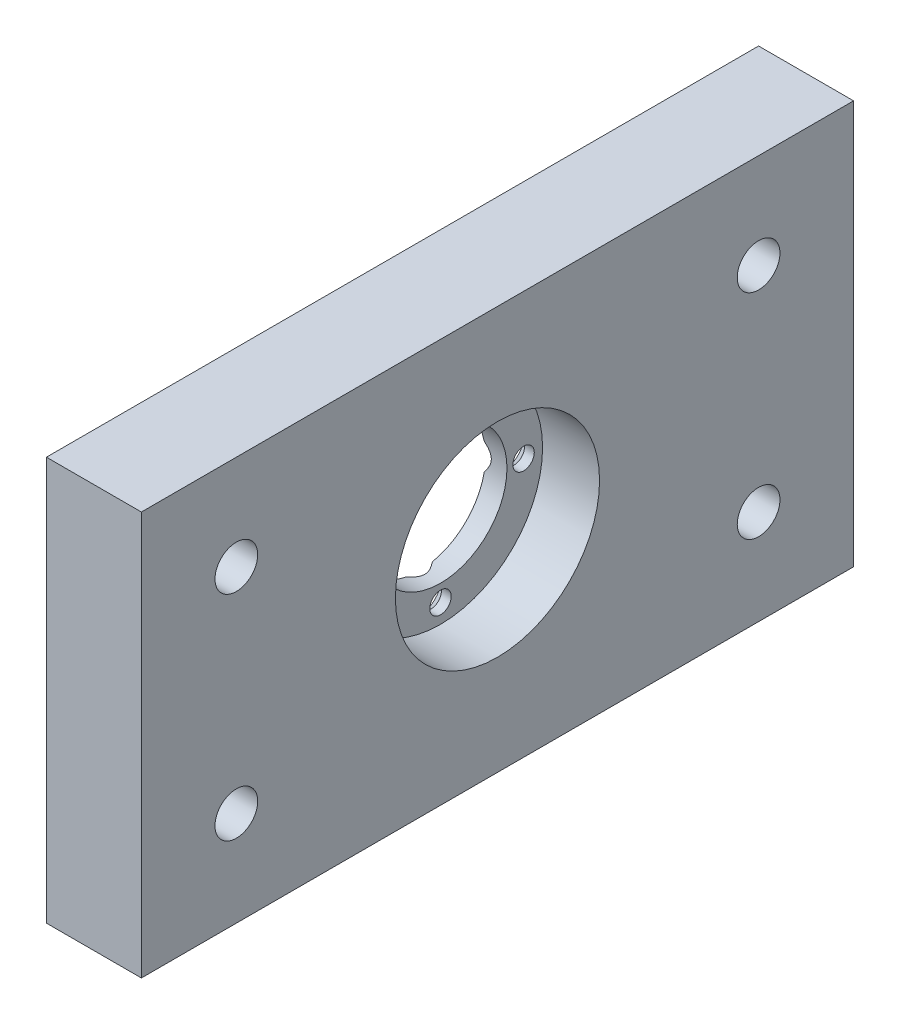
from build123d import *

# Parameters (mm, degrees)
BOSS_EXTRUDE1_DEPTH                             = 4.75
BOSS_EXTRUDE1_DEPTH_BACK                        = 15.25
SKETCH1_W                                       = 150
SKETCH1_H                                       = 85
SKETCH2_R                                       = 21.5
F_1MM_CLEARANCE_DEPTH                           = 12
SKETCH5_R                                       = 41
CUT_EXTRUDE2_DEPTH                              = 3.5
SKETCH6_R                                       = 14
CUT_EXTRUDE3_DEPTH                              = 11.5
CSK_FOR_M8_FLAT_HEAD_MACHINE_SCREW1_D           = 9
CSK_FOR_M8_FLAT_HEAD_MACHINE_SCREW1_CSINK_D     = 17.3
CSK_FOR_M8_FLAT_HEAD_MACHINE_SCREW1_CSINK_ANGLE = 90
CSK_FOR_M4_FLAT_HEAD_MACHINE_SCREW1_D           = 4.5
CSK_FOR_M4_FLAT_HEAD_MACHINE_SCREW1_CSINK_D     = 9.4
CSK_FOR_M4_FLAT_HEAD_MACHINE_SCREW1_CSINK_ANGLE = 90
M4X0_7_TAPPED_HOLE1_D                           = 3.3
M4X0_7_TAPPED_HOLE1_DEPTH                       = 10.1
M4X0_7_TAPPED_HOLE1_TIP                         = 0.991420021


with BuildPart() as part:
    # Sketch1 → Boss-Extrude1 (new, two sides: drawn at the far end of the back side and taken through both)
    with BuildSketch(Plane.ZY.offset(-152.244801117).offset(-BOSS_EXTRUDE1_DEPTH_BACK)):
        with Locations((-933.40139902, 151.879264394)):
            Rectangle(SKETCH1_W, SKETCH1_H)
    extrude(amount=BOSS_EXTRUDE1_DEPTH + BOSS_EXTRUDE1_DEPTH_BACK)

    # Sketch2 → 1mm clearance (cut)
    with BuildSketch(Plane(origin=(167.494801117, 0, 0), x_dir=(0, 0, -1), z_dir=(1, 0, 0))):
        with Locations((933.40139902, 151.879264394)):
            Circle(SKETCH2_R)
    extrude(amount=-F_1MM_CLEARANCE_DEPTH, mode=Mode.SUBTRACT)

    # Sketch5 → Cut-Extrude2 (cut)
    with BuildSketch(Plane.ZY.offset(-147.494801117)):
        with Locations((-933.40139902, 151.879264394)):
            Circle(SKETCH5_R)
    extrude(amount=-CUT_EXTRUDE2_DEPTH, mode=Mode.SUBTRACT)

    # Sketch6 → Cut-Extrude3 (cut)
    with BuildSketch(Plane.ZY.offset(-150.994801117)):
        with Locations((-933.40139902, 151.879264394)):
            Circle(SKETCH6_R)
    extrude(amount=-CUT_EXTRUDE3_DEPTH, mode=Mode.SUBTRACT)

    # CSK for M8 Flat Head Machine Screw1 (through all)
    with Locations(Plane.ZY.offset(-147.494801117)):
        with Locations((-878.40139902, 129.379264394), (-878.40139902, 174.379264394), (-988.40139902, 129.379264394), (-988.40139902, 174.379264394)):
            CounterSinkHole(CSK_FOR_M8_FLAT_HEAD_MACHINE_SCREW1_D / 2, CSK_FOR_M8_FLAT_HEAD_MACHINE_SCREW1_CSINK_D / 2, counter_sink_angle=CSK_FOR_M8_FLAT_HEAD_MACHINE_SCREW1_CSINK_ANGLE)

    # CSK for M4 Flat Head Machine Screw1 (through all)
    with Locations(Plane.ZY.offset(-150.994801117)):
        with Locations((-933.40139902, 134.379264394), (-950.90139902, 151.879264394), (-915.90139902, 151.879264394), (-933.40139902, 169.379264394)):
            CounterSinkHole(CSK_FOR_M4_FLAT_HEAD_MACHINE_SCREW1_D / 2, CSK_FOR_M4_FLAT_HEAD_MACHINE_SCREW1_CSINK_D / 2, counter_sink_angle=CSK_FOR_M4_FLAT_HEAD_MACHINE_SCREW1_CSINK_ANGLE)

    # M4x0.7 Tapped Hole1
    with Locations(Plane.ZY.offset(-147.494801117)):
        with Locations((-878.40139902, 151.879264394), (-973.40139902, 121.879264394), (-973.40139902, 181.879264394)):
            Hole(M4X0_7_TAPPED_HOLE1_D / 2, depth=M4X0_7_TAPPED_HOLE1_DEPTH)
            with Locations((0, 0, -(M4X0_7_TAPPED_HOLE1_DEPTH + M4X0_7_TAPPED_HOLE1_TIP / 2))):  # 118° drill point
                Cone(0, M4X0_7_TAPPED_HOLE1_D / 2, M4X0_7_TAPPED_HOLE1_TIP, mode=Mode.SUBTRACT)


solid = part.part
